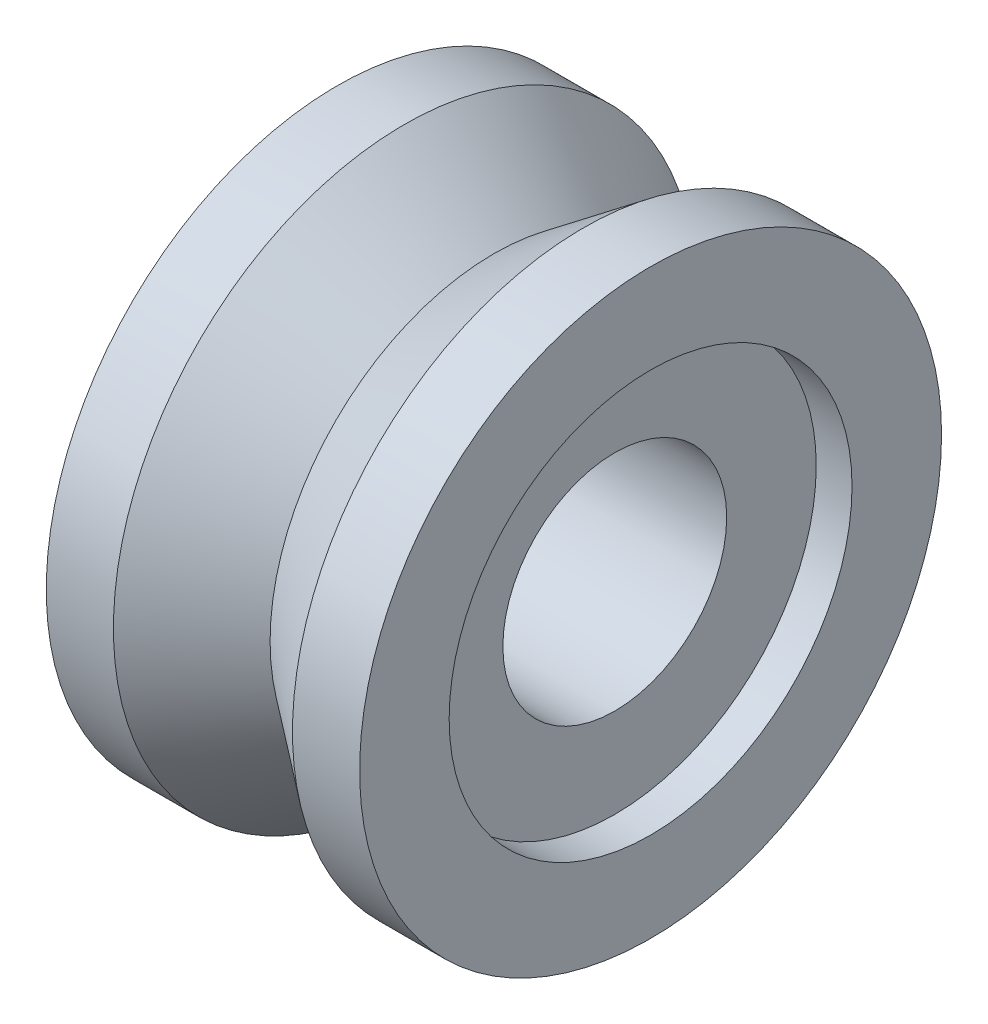
from build123d import *

# Parameters (mm, degrees)
SKETCH1_R               = 6.5
BOSS_EXTRUDE1_DEPTH     = 3.5
SKETCH4_R               = 4.5
CUT_EXTRUDE1_DEPTH      = 0.8
CUT_EXTRUDE2_DEPTH      = 10.836157786
CUT_EXTRUDE2_DEPTH_BACK = 10.836157786
SKETCH5_R               = 2.5


with BuildPart() as part:
    # Sketch1 → Boss-Extrude1 (new, symmetric)
    with BuildSketch(Plane(origin=(0, 0, 0), x_dir=(0, 0, -1), z_dir=(1, 0, 0))):
        Circle(SKETCH1_R)
    extrude(amount=BOSS_EXTRUDE1_DEPTH, both=True)

    # Sketch2 → Cut-Revolve1 (revolve, cut)
    with BuildSketch(Plane.XY):
        Polygon((-2, 6.5), (0, 5), (2, 6.5), align=None)
    revolve(axis=Axis((3.5, 0, 0), (-1, 0, 0)), mode=Mode.SUBTRACT)

    # Sketch4 → Cut-Extrude1 (cut)
    with BuildSketch(Plane(origin=(3.5, 0, 0), x_dir=(0, 0, -1), z_dir=(1, 0, 0))):
        Circle(SKETCH4_R)
    cut_extrude1 = extrude(amount=-CUT_EXTRUDE1_DEPTH, mode=Mode.SUBTRACT)

    # Mirror1: Cut-Extrude1 across plane
    add(cut_extrude1.mirror(Plane(origin=(0, 0, 0), x_dir=(0, 0, 1), z_dir=(1, 0, 0))), mode=Mode.SUBTRACT)

    # Sketch5 → Cut-Extrude2 (cut, two sides: drawn at the far end of the back side and taken through both)
    with BuildSketch(Plane(origin=(0, 0, 0), x_dir=(0, 0, -1), z_dir=(1, 0, 0)).offset(-CUT_EXTRUDE2_DEPTH_BACK)):
        Circle(SKETCH5_R)
    extrude(amount=CUT_EXTRUDE2_DEPTH + CUT_EXTRUDE2_DEPTH_BACK, mode=Mode.SUBTRACT)


solid = part.part
